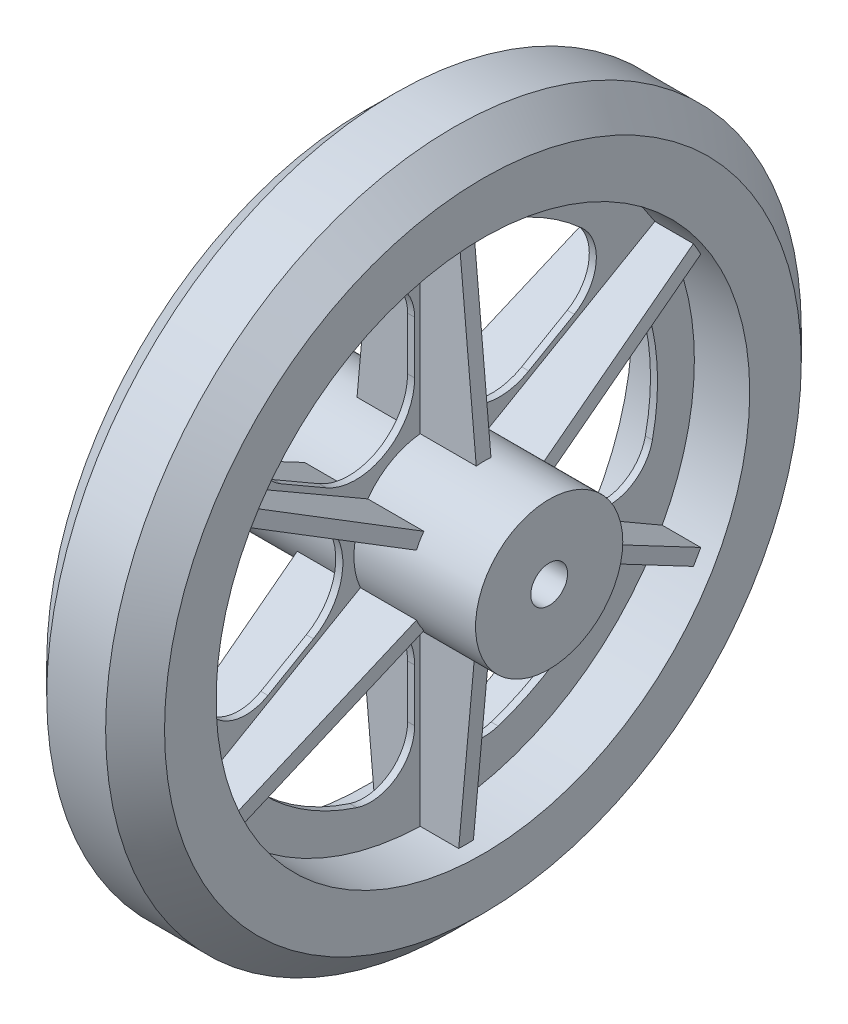
from build123d import *

# Parameters (mm, degrees)
BOSS_EXTRUDE1_DEPTH      = 26.9875
BOSS_EXTRUDE1_DEPTH_BACK = 26.9875
SKETCH1_R                = 15.875
BOSS_EXTRUDE2_DEPTH      = 0.762
BOSS_EXTRUDE2_DEPTH_BACK = 0.762
SKETCH2_R                = 75
BOSS_EXTRUDE3_DEPTH      = 12.7
BOSS_EXTRUDE3_DEPTH_BACK = 12.7
SKETCH3_R                = 75
SKETCH3_R_2              = 57.5375
CUT_EXTRUDE1_DEPTH       = 110.445535113
CIRPATTERN1_COUNT        = 6
CUT_EXTRUDE2_DEPTH       = 110.445535138
CUT_EXTRUDE2_DEPTH_BACK  = 110.445535138
SKETCH9_R                = 3.96875
CHAMFER1_SIZE            = 6.35


with BuildPart() as part:
    # Sketch1 → Boss-Extrude1 (new, two sides: drawn at the far end of the back side and taken through both)
    with BuildSketch(Plane(origin=(0, 0, 0), x_dir=(0, 0, -1), z_dir=(1, 0, 0)).offset(-BOSS_EXTRUDE1_DEPTH_BACK)):
        Circle(SKETCH1_R)
    extrude(amount=BOSS_EXTRUDE1_DEPTH + BOSS_EXTRUDE1_DEPTH_BACK)

    # Sketch2 → Boss-Extrude2 (add, two sides: drawn at the far end of the back side and taken through both)
    with BuildSketch(Plane(origin=(0, 0, 0), x_dir=(0, 0, -1), z_dir=(1, 0, 0)).offset(-BOSS_EXTRUDE2_DEPTH_BACK)):
        Circle(SKETCH2_R)
    extrude(amount=BOSS_EXTRUDE2_DEPTH + BOSS_EXTRUDE2_DEPTH_BACK)

    # Sketch3 → Boss-Extrude3 (add, two sides: drawn at the far end of the back side and taken through both)
    with BuildSketch(Plane(origin=(0, 0, 0), x_dir=(0, 0, -1), z_dir=(1, 0, 0)).offset(-BOSS_EXTRUDE3_DEPTH_BACK)):
        Circle(SKETCH3_R)
        Circle(SKETCH3_R_2, mode=Mode.SUBTRACT)
    extrude(amount=BOSS_EXTRUDE3_DEPTH + BOSS_EXTRUDE3_DEPTH_BACK)

    # Sketch4 → Cut-Extrude1 (cut, symmetric)
    with BuildSketch(Plane(origin=(0, 0, 0), x_dir=(0, 0, -1), z_dir=(1, 0, 0))):
        with BuildLine():
            Line((31.640909573, 21.475790093), (21.828125, 15.810376278))
            ThreePointArc((21.828125, 15.810376278), (9.128125, 15.810376278), (2.778125, 26.808898906))
            Line((2.778125, 26.808898906), (2.778125, 38.139726536))
            ThreePointArc((2.778125, 38.139726536), (6.696315224, 45.839681674), (15.227323768, 47.204751995))
            ThreePointArc((15.227323768, 47.204751995), (24.8, 42.954860028), (33.266852523, 36.789625212))
            ThreePointArc((33.266852523, 36.789625212), (36.350171219, 28.719019933), (31.640909573, 21.475790093))
        make_face()
    cut_extrude1 = extrude(amount=CUT_EXTRUDE1_DEPTH, both=True, mode=Mode.SUBTRACT)

    # Sketch5 → Loft1 section 0
    with BuildSketch(Plane(origin=(0, 0, 0), x_dir=(1, 0, 0), z_dir=(0, 1, 0))):
        with BuildLine():
            Line((-14.2875, -1.5875), (14.2875, -1.5875))
            Line((14.2875, -1.5875), (14.2875, 1.5875))
            Line((14.2875, 1.5875), (-14.2875, 1.5875))
            Line((-14.2875, 1.5875), (-14.2875, -1.5875))
        make_face()
    # Sketch6 → Loft1 section 1
    with BuildSketch(Plane(origin=(0, 70, 0), x_dir=(-1, 0, 0), z_dir=(0, 1, 0))):
        with BuildLine():
            Line((7.9375, 1.5875), (-7.9375, 1.5875))
            Line((-7.9375, 1.5875), (-7.9375, -1.5875))
            Line((-7.9375, -1.5875), (7.9375, -1.5875))
            Line((7.9375, -1.5875), (7.9375, 1.5875))
        make_face()
    loft1 = loft()

    # CirPattern1: Cut-Extrude1, Loft1 ×6 about axis
    cirpattern1_axis = Axis((0, 0, 0), (1, 0, 0))
    add([cut_extrude1.rotate(cirpattern1_axis, i * 360 / CIRPATTERN1_COUNT) for i in range(1, CIRPATTERN1_COUNT)], mode=Mode.SUBTRACT)
    add([loft1.rotate(cirpattern1_axis, i * 360 / CIRPATTERN1_COUNT) for i in range(1, CIRPATTERN1_COUNT)])

    # Sketch9 → Cut-Extrude2 (cut, two sides: drawn at the far end of the back side and taken through both)
    with BuildSketch(Plane(origin=(0, 0, 0), x_dir=(0, 0, -1), z_dir=(1, 0, 0)).offset(-CUT_EXTRUDE2_DEPTH_BACK)):
        Circle(SKETCH9_R)
    extrude(amount=CUT_EXTRUDE2_DEPTH + CUT_EXTRUDE2_DEPTH_BACK, mode=Mode.SUBTRACT)

    # Chamfer1
    chamfer1_edges = [part.edges().sort_by_distance(p)[0] for p in [
        (-12.7, 0, 75),
        (12.7, 0, 75),
    ]]
    chamfer(chamfer1_edges, length=CHAMFER1_SIZE)


solid = part.part
